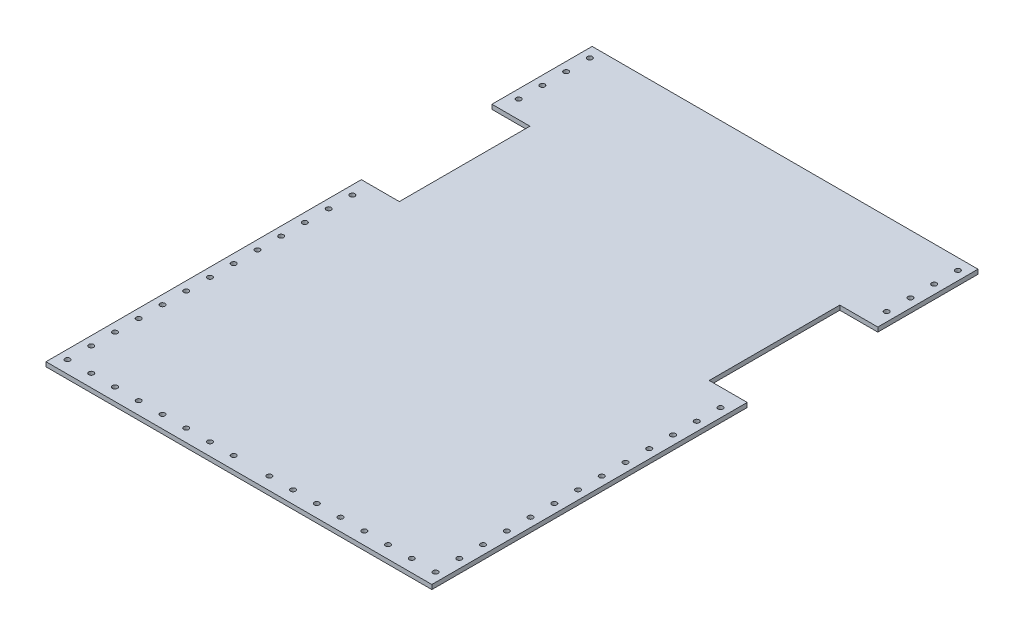
from build123d import *

# Parameters (mm, degrees)
SKETCH1_W           = 412.75
SKETCH1_H           = 584.2
BOSS_EXTRUDE1_DEPTH = 4.7625
SKETCH2_W           = 40.64
SKETCH2_H           = 139.7
CUT_EXTRUDE1_DEPTH  = 716.314534947
SKETCH3_R           = 2.667
CUT_EXTRUDE2_DEPTH  = 254


with BuildPart() as part:
    # Sketch1 → Boss-Extrude1 (new body)
    with BuildSketch(Plane(origin=(0, 0, 0), x_dir=(1, 0, 0), z_dir=(0, 1, 0))):
        with Locations((206.375, 292.1)):
            Rectangle(SKETCH1_W, SKETCH1_H)
    extrude(amount=BOSS_EXTRUDE1_DEPTH)

    # Sketch2 → Cut-Extrude1 (cut, through all)
    with BuildSketch(Plane(origin=(0, 4.7625, 0), x_dir=(1, 0, 0), z_dir=(0, 1, 0))):
        with Locations((20.32, 407.162)):
            Rectangle(SKETCH2_W, SKETCH2_H)
        with Locations((392.43, 407.162)):
            Rectangle(SKETCH2_W, SKETCH2_H)
    extrude(amount=-CUT_EXTRUDE1_DEPTH, mode=Mode.SUBTRACT)

    # Sketch3 → Cut-Extrude2 (cut)
    with BuildSketch(Plane(origin=(0, 4.7625, 0), x_dir=(1, 0, 0), z_dir=(0, 1, 0))):
        with Locations(Location((9.525, 13.462, 0), (0, 0, 270))):
            Circle(SKETCH3_R)
        with Locations(Location((34.925, 13.462, 0), (0, 0, 270))):
            Circle(SKETCH3_R)
        with Locations(Location((60.325, 13.462, 0), (0, 0, 270))):
            Circle(SKETCH3_R)
        with Locations(Location((85.725, 13.462, 0), (0, 0, 270))):
            Circle(SKETCH3_R)
        with Locations(Location((111.125, 13.462, 0), (0, 0, 270))):
            Circle(SKETCH3_R)
        with Locations(Location((136.525, 13.462, 0), (0, 0, 270))):
            Circle(SKETCH3_R)
        with Locations(Location((161.925, 13.462, 0), (0, 0, 270))):
            Circle(SKETCH3_R)
        with Locations(Location((187.325, 13.462, 0), (0, 0, 270))):
            Circle(SKETCH3_R)
        with Locations(Location((225.425, 13.462, 0), (0, 0, 270))):
            Circle(SKETCH3_R)
        with Locations(Location((250.825, 13.462, 0), (0, 0, 270))):
            Circle(SKETCH3_R)
        with Locations(Location((276.225, 13.462, 0), (0, 0, 270))):
            Circle(SKETCH3_R)
        with Locations(Location((301.625, 13.462, 0), (0, 0, 270))):
            Circle(SKETCH3_R)
        with Locations(Location((327.025, 13.462, 0), (0, 0, 270))):
            Circle(SKETCH3_R)
        with Locations(Location((352.425, 13.462, 0), (0, 0, 270))):
            Circle(SKETCH3_R)
        with Locations(Location((377.825, 13.462, 0), (0, 0, 270))):
            Circle(SKETCH3_R)
        with Locations(Location((403.225, 13.462, 0), (0, 0, 270))):
            Circle(SKETCH3_R)
        with Locations(Location((403.225, 38.862, 0), (0, 0, 270))):
            Circle(SKETCH3_R)
        with Locations(Location((403.225, 64.262, 0), (0, 0, 270))):
            Circle(SKETCH3_R)
        with Locations(Location((403.225, 89.662, 0), (0, 0, 270))):
            Circle(SKETCH3_R)
        with Locations(Location((403.225, 115.062, 0), (0, 0, 270))):
            Circle(SKETCH3_R)
        with Locations(Location((403.225, 140.462, 0), (0, 0, 270))):
            Circle(SKETCH3_R)
        with Locations(Location((403.225, 165.862, 0), (0, 0, 270))):
            Circle(SKETCH3_R)
        with Locations(Location((403.225, 191.262, 0), (0, 0, 270))):
            Circle(SKETCH3_R)
        with Locations(Location((403.225, 216.662, 0), (0, 0, 270))):
            Circle(SKETCH3_R)
        with Locations(Location((403.225, 242.062, 0), (0, 0, 270))):
            Circle(SKETCH3_R)
        with Locations(Location((403.225, 267.462, 0), (0, 0, 270))):
            Circle(SKETCH3_R)
        with Locations(Location((403.225, 292.862, 0), (0, 0, 270))):
            Circle(SKETCH3_R)
        with Locations(Location((403.225, 318.262, 0), (0, 0, 270))):
            Circle(SKETCH3_R)
        with Locations((403.225, 343.662)):
            Circle(SKETCH3_R)
        with Locations((403.225, 369.062)):
            Circle(SKETCH3_R)
        with Locations((403.225, 394.462)):
            Circle(SKETCH3_R)
        with Locations((403.225, 419.862)):
            Circle(SKETCH3_R)
        with Locations((403.225, 445.262)):
            Circle(SKETCH3_R)
        with Locations((403.225, 470.662)):
            Circle(SKETCH3_R)
        with Locations(Location((403.225, 496.062, 0), (0, 0, 270))):
            Circle(SKETCH3_R)
        with Locations(Location((403.225, 521.462, 0), (0, 0, 270))):
            Circle(SKETCH3_R)
        with Locations(Location((403.225, 546.862, 0), (0, 0, 270))):
            Circle(SKETCH3_R)
        with Locations(Location((403.225, 572.262, 0), (0, 0, 270))):
            Circle(SKETCH3_R)
        with Locations(Location((9.525, 38.862, 0), (0, 0, 270))):
            Circle(SKETCH3_R)
        with Locations(Location((9.525, 64.262, 0), (0, 0, 270))):
            Circle(SKETCH3_R)
        with Locations(Location((9.525, 89.662, 0), (0, 0, 270))):
            Circle(SKETCH3_R)
        with Locations(Location((9.525, 115.062, 0), (0, 0, 270))):
            Circle(SKETCH3_R)
        with Locations(Location((9.525, 140.462, 0), (0, 0, 270))):
            Circle(SKETCH3_R)
        with Locations(Location((9.525, 165.862, 0), (0, 0, 270))):
            Circle(SKETCH3_R)
        with Locations(Location((9.525, 191.262, 0), (0, 0, 270))):
            Circle(SKETCH3_R)
        with Locations(Location((9.525, 216.662, 0), (0, 0, 270))):
            Circle(SKETCH3_R)
        with Locations(Location((9.525, 242.062, 0), (0, 0, 270))):
            Circle(SKETCH3_R)
        with Locations(Location((9.525, 267.462, 0), (0, 0, 270))):
            Circle(SKETCH3_R)
        with Locations(Location((9.525, 292.862, 0), (0, 0, 270))):
            Circle(SKETCH3_R)
        with Locations(Location((9.525, 318.262, 0), (0, 0, 270))):
            Circle(SKETCH3_R)
        with Locations((9.525, 343.662)):
            Circle(SKETCH3_R)
        with Locations((9.525, 369.062)):
            Circle(SKETCH3_R)
        with Locations((9.525, 394.462)):
            Circle(SKETCH3_R)
        with Locations((9.525, 419.862)):
            Circle(SKETCH3_R)
        with Locations((9.525, 445.262)):
            Circle(SKETCH3_R)
        with Locations((9.525, 470.662)):
            Circle(SKETCH3_R)
        with Locations(Location((9.525, 496.062, 0), (0, 0, 270))):
            Circle(SKETCH3_R)
        with Locations(Location((9.525, 521.462, 0), (0, 0, 270))):
            Circle(SKETCH3_R)
        with Locations(Location((9.525, 546.862, 0), (0, 0, 270))):
            Circle(SKETCH3_R)
        with Locations(Location((9.525, 572.262, 0), (0, 0, 270))):
            Circle(SKETCH3_R)
    extrude(amount=-CUT_EXTRUDE2_DEPTH, mode=Mode.SUBTRACT)


solid = part.part
